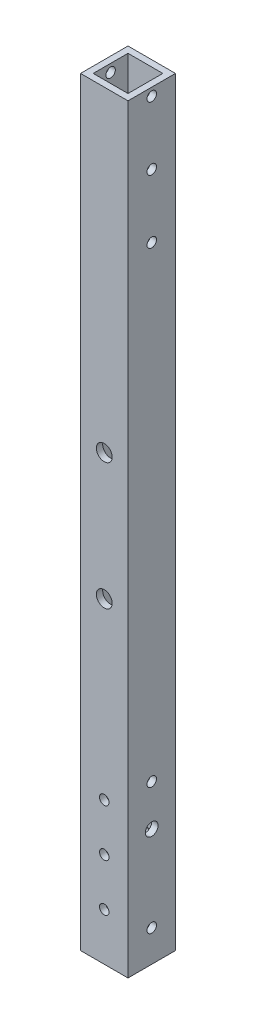
from build123d import *

# Parameters (mm, degrees)
SKETCH_1_W          = 15
SKETCH_1_H          = 15
EXTRUDE_1_DEPTH     = 240
SKETCH_2_W          = 11
SKETCH_2_H          = 11
CUT_EXTRUDE_1_DEPTH = 240
SKETCH_3_R          = 2.5
CUT_EXTRUDE_2_DEPTH = 15
SKETCH_4_R          = 1.5
CUT_EXTRUDE_3_DEPTH = 15
SKETCH_5_R          = 1.5
SKETCH_5_R_2        = 2
CUT_EXTRUDE_4_DEPTH = 15


with BuildPart() as part:
    # 草图1 → 凸台-拉伸1 (new body)
    with BuildSketch(Plane(origin=(0, 0, 0), x_dir=(1, 0, 0), z_dir=(0, 1, 0))):
        Rectangle(SKETCH_1_W, SKETCH_1_H)
    extrude(amount=EXTRUDE_1_DEPTH)

    # 草图2 → 切除-拉伸1 (cut)
    with BuildSketch(Plane(origin=(0, 240, 0), x_dir=(1, 0, 0), z_dir=(0, 1, 0))):
        Rectangle(SKETCH_2_W, SKETCH_2_H)
    extrude(amount=-CUT_EXTRUDE_1_DEPTH, mode=Mode.SUBTRACT)

    # 草图3 → 切除-拉伸2 (cut)
    with BuildSketch(Plane.XY.offset(7.5)):
        with Locations((0, 140)):
            Circle(SKETCH_3_R)
        with Locations((0, 100)):
            Circle(SKETCH_3_R)
    extrude(amount=-CUT_EXTRUDE_2_DEPTH, mode=Mode.SUBTRACT)

    # 草图4 → 切除-拉伸3 (cut)
    with BuildSketch(Plane.XY.offset(7.5)):
        with Locations((0, 45)):
            Circle(SKETCH_4_R)
        with Locations((0, 30)):
            Circle(SKETCH_4_R)
        with Locations((0, 15)):
            Circle(SKETCH_4_R)
    extrude(amount=-CUT_EXTRUDE_3_DEPTH, mode=Mode.SUBTRACT)

    # 草图5 → 切除-拉伸4 (cut)
    with BuildSketch(Plane.ZY.offset(7.5)):
        with Locations((0, 10)):
            Circle(SKETCH_5_R)
        with Locations((0, 37)):
            Circle(SKETCH_5_R_2)
        with Locations((0, 50)):
            Circle(SKETCH_5_R)
        with Locations((0, 237.5)):
            Circle(SKETCH_5_R)
        with Locations((0, 217.5)):
            Circle(SKETCH_5_R)
        with Locations((0, 197.5)):
            Circle(SKETCH_5_R)
    extrude(amount=-CUT_EXTRUDE_4_DEPTH, mode=Mode.SUBTRACT)


solid = part.part
